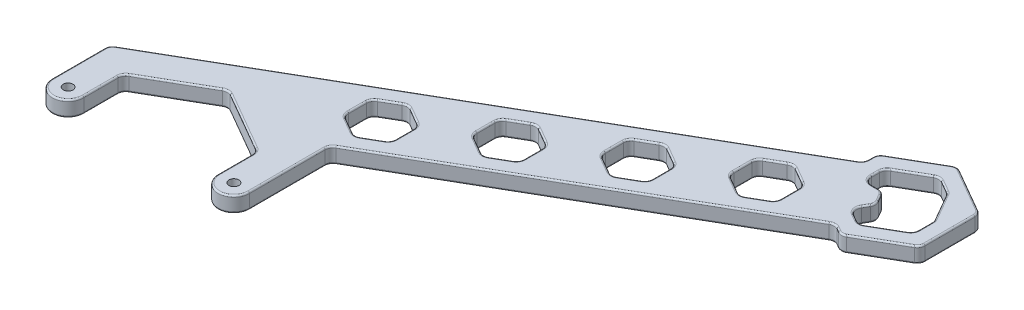
from build123d import *

# Parameters (mm, degrees)
SKETCH1_R              = 2
BOSS_EXTRUDE2_DEPTH    = 6.35
FILLET1_R              = 3.175
FILLET4_R              = 0.635
CUT_EXTRUDE1_DEPTH     = 279.279824808
FILLET3_R              = 3.175
FILLET5_R              = 0.635
LPATTERN2_COUNT        = 4
LPATTERN2_PITCH        = 38.1
FILLET3_OF_LPATTERN2_R = 3.175
FILLET5_OF_LPATTERN2_R = 0.635


with BuildPart() as part:
    # Sketch1 → Boss-Extrude2 (new body)
    with BuildSketch(Plane(origin=(0, 0, 0), x_dir=(1, 0, 0), z_dir=(0, 1, 0))):
        with BuildLine():
            Line((153.979316793, 181.256286034), (-39.941927169, 69.295803631))
            Line((-39.941927169, 69.295803631), (-39.941927169, 46.235321229))
            ThreePointArc((-39.941927169, 46.235321229), (-33.591927169, 39.885321229), (-27.241927169, 46.235321229))
            Line((-27.241927169, 46.235321229), (-27.241927169, 61.963455213))
            Line((-27.241927169, 61.963455213), (0, 77.691589197))
            Line((0, 77.691589197), (27.241927169, 61.963455213))
            Line((27.241927169, 61.963455213), (27.241927169, 46.235321229))
            ThreePointArc((27.241927169, 46.235321229), (33.591927169, 39.885321229), (39.941927169, 46.235321229))
            Line((39.941927169, 46.235321229), (39.941927169, 78.755026343))
            Line((39.941927169, 78.755026343), (169.854316793, 153.759979464))
            Line((169.854316793, 153.759979464), (174.616816793, 151.010348807))
            Line((174.616816793, 151.010348807), (195.254316793, 162.925414987))
            Line((195.254316793, 162.925414987), (195.254316793, 186.755547348))
            Line((195.254316793, 186.755547348), (174.616816793, 198.670613528))
            Line((174.616816793, 198.670613528), (153.979316793, 186.755547348))
            Line((153.979316793, 186.755547348), (153.979316793, 181.256286034))
        make_face()
        Polygon((174.616816793, 191.33826511), (181.760566793, 187.213819124), (188.904316793, 174.840481168), (188.904316793, 166.591589197), (174.616816793, 158.342697225), (167.473066793, 162.467143211), (171.316992662, 169.125018117), (168.017168531, 174.840481168), (160.329316793, 174.840481168), (160.329316793, 183.089373139), align=None, mode=Mode.SUBTRACT)
        with Locations((33.591927169, 46.235321229)):
            Circle(SKETCH1_R, mode=Mode.SUBTRACT)
        with Locations((-33.591927169, 46.235321229)):
            Circle(SKETCH1_R, mode=Mode.SUBTRACT)
    extrude(amount=BOSS_EXTRUDE2_DEPTH)

    # Fillet1
    fillet1_edges = [part.edges().sort_by_distance(p)[0] for p in [
        (-39.941927169, 3.175, -69.295803631),
        (27.241927169, 3.175, -61.963455213),
        (0, 3.175, -77.691589197),
        (-27.241927169, 3.175, -61.963455213),
        (39.941927169, 3.175, -78.755026343),
        (167.473066793, 3.175, -162.467143211),
        (160.329316793, 3.175, -174.840481168),
        (174.616816793, 3.175, -158.342697225),
        (188.904316793, 3.175, -166.591589197),
        (174.616816793, 3.175, -191.33826511),
        (160.329316793, 3.175, -183.089373139),
        (153.979316793, 3.175, -181.256286034),
        (153.979316793, 3.175, -186.755547348),
        (174.616816793, 3.175, -198.670613528),
        (195.254316793, 3.175, -186.755547348),
        (195.254316793, 3.175, -162.925414987),
        (174.616816793, 3.175, -151.010348807),
        (169.854316793, 3.175, -153.759979464),
        (188.904316793, 3.175, -174.840481168),
        (181.760566793, 3.175, -187.213819124),
        (168.017168531, 3.175, -174.840481168),
        (171.316992662, 3.175, -169.125018117),
    ]]
    fillet(fillet1_edges, radius=FILLET1_R)

    # Fillet4
    fillet4_edges = [part.edges().sort_by_distance(p)[0] for p in [
        (40.367296511, 6.35, -78.509439238),
        (39.941927169, 6.35, -61.578630233),
        (33.591927169, 6.35, -39.885321229),
        (27.241927169, 6.35, -53.182844668),
        (26.816557826, 6.35, -61.717868108),
        (13.620963584, 6.35, -69.827522205),
        (0, 6.35, -77.200414987),
        (-13.620963584, 6.35, -69.827522205),
        (-26.816557826, 6.35, -61.717868108),
        (-27.241927169, 6.35, -53.182844668),
        (-33.591927169, 6.35, -39.885321229),
        (-39.941927169, 6.35, -56.849018878),
        (-39.516557826, 6.35, -69.050216527),
        (57.018694812, 6.35, -125.276044833),
        (153.55394745, 6.35, -181.501873139),
        (153.979316793, 6.35, -184.005916691),
        (154.404686136, 6.35, -186.509960243),
        (164.298066793, 6.35, -192.713080438),
        (174.616816793, 6.35, -198.179439319),
        (184.935566793, 6.35, -192.713080438),
        (194.82894745, 6.35, -186.509960243),
        (195.254316793, 6.35, -174.840481168),
        (194.82894745, 6.35, -163.171002092),
        (184.935566793, 6.35, -156.967881897),
        (174.616816793, 6.35, -151.501523016),
        (172.235566793, 6.35, -152.385164135),
        (169.854316793, 6.35, -153.268805254),
        (104.898121981, 6.35, -116.257502903),
        (-39.516557826, 0, -69.050216527),
        (-39.941927169, 0, -56.849018878),
        (-33.591927169, 0, -39.885321229),
        (-27.241927169, 0, -53.182844668),
        (-26.816557826, 0, -61.717868108),
        (-13.620963584, 0, -69.827522205),
        (0, 0, -77.200414987),
        (13.620963584, 0, -69.827522205),
        (26.816557826, 0, -61.717868108),
        (27.241927169, 0, -53.182844668),
        (33.591927169, 0, -39.885321229),
        (39.941927169, 0, -61.578630233),
        (40.367296511, 0, -78.509439238),
        (104.898121981, 0, -116.257502903),
        (169.854316793, 0, -153.268805254),
        (172.235566793, 0, -152.385164135),
        (174.616816793, 0, -151.501523016),
        (184.935566793, 0, -156.967881897),
        (194.82894745, 0, -163.171002092),
        (195.254316793, 0, -174.840481168),
        (194.82894745, 0, -186.509960243),
        (184.935566793, 0, -192.713080438),
        (174.616816793, 0, -198.179439319),
        (164.298066793, 0, -192.713080438),
        (154.404686136, 0, -186.509960243),
        (153.979316793, 0, -184.005916691),
        (153.55394745, 0, -181.501873139),
        (57.018694812, 0, -125.276044833),
        (181.681369509, 0, -187.13462184),
        (178.614061136, 0, -189.030455012),
        (174.616816793, 0, -190.8470909),
        (167.473066793, 0, -187.213819124),
        (160.754686136, 0, -182.843786034),
        (160.329316793, 0, -179.635883601),
        (161.259252763, 0, -175.770417137),
        (164.844199109, 0, -174.840481168),
        (167.771581426, 0, -174.415111825),
        (169.667080596, 0, -171.982749642),
        (170.825818452, 0, -169.125018117),
        (169.730507951, 0, -166.377145992),
        (168.743382951, 0, -162.8075234),
        (171.626007121, 0, -160.069441994),
        (174.616816793, 0, -158.833871435),
        (181.760566793, 0, -162.467143211),
        (188.47894745, 0, -166.837176301),
        (188.904316793, 0, -171.207209391),
        (188.796131291, 0, -174.81149295),
        (181.681369509, 6.35, -187.13462184),
        (178.614061136, 6.35, -189.030455012),
        (174.616816793, 6.35, -190.8470909),
        (167.473066793, 6.35, -187.213819124),
        (160.754686136, 6.35, -182.843786034),
        (160.329316793, 6.35, -179.635883601),
        (161.259252763, 6.35, -175.770417137),
        (164.844199109, 6.35, -174.840481168),
        (167.771581426, 6.35, -174.415111825),
        (169.667080596, 6.35, -171.982749642),
        (170.825818452, 6.35, -169.125018117),
        (169.730507951, 6.35, -166.377145992),
        (168.743382951, 6.35, -162.8075234),
        (171.626007121, 6.35, -160.069441994),
        (174.616816793, 6.35, -158.833871435),
        (181.760566793, 6.35, -162.467143211),
        (188.47894745, 6.35, -166.837176301),
        (188.904316793, 6.35, -171.207209391),
        (188.796131291, 6.35, -174.81149295),
        (185.332441793, 0, -181.027150146),
        (185.332441793, 6.35, -181.027150146),
    ]]
    fillet(fillet4_edges, radius=FILLET4_R)

    # Sketch3 → Cut-Extrude1 (cut, through all)
    with BuildSketch(Plane(origin=(0, 6.35, 0), x_dir=(1, 0, 0), z_dir=(0, 1, 0))):
        Polygon((41.529427169, 109.00096357), (32.004427169, 103.501702256), (32.004427169, 92.503179628), (41.529427169, 87.003918314), (51.054427169, 92.503179628), (51.054427169, 103.501702256), align=None)
    cut_extrude1 = extrude(amount=-CUT_EXTRUDE1_DEPTH, mode=Mode.SUBTRACT)

    # Fillet3
    fillet3_edges = [part.edges().sort_by_distance(p)[0] for p in [
        (32.004427169, 3.175, -92.503179628),
        (41.529427169, 3.175, -87.003918314),
        (51.054427169, 3.175, -92.503179628),
        (51.054427169, 3.175, -103.501702256),
        (41.529427169, 3.175, -109.00096357),
        (32.004427169, 3.175, -103.501702256),
    ]]
    fillet(fillet3_edges, radius=FILLET3_R)

    # Fillet5
    fillet5_edges = [part.edges().sort_by_distance(p)[0] for p in [
        (50.629057826, 0, -103.256115152),
        (51.054427169, 0, -98.002440942),
        (50.629057826, 0, -92.748766733),
        (46.291927169, 0, -89.753548971),
        (41.529427169, 0, -87.495092523),
        (36.766927169, 0, -89.753548971),
        (32.429796511, 0, -92.748766733),
        (32.004427169, 0, -98.002440942),
        (32.429796511, 0, -103.256115152),
        (36.766927169, 0, -106.251332913),
        (41.529427169, 0, -108.509789361),
        (41.529427169, 6.35, -108.509789361),
        (46.291927169, 6.35, -106.251332913),
        (50.629057826, 6.35, -103.256115152),
        (51.054427169, 6.35, -98.002440942),
        (50.629057826, 6.35, -92.748766733),
        (46.291927169, 6.35, -89.753548971),
        (41.529427169, 6.35, -87.495092523),
        (36.766927169, 6.35, -89.753548971),
        (32.429796511, 6.35, -92.748766733),
        (32.004427169, 6.35, -98.002440942),
        (32.429796511, 6.35, -103.256115152),
        (46.291927169, 0, -106.251332913),
        (36.766927169, 6.35, -106.251332913),
    ]]
    fillet(fillet5_edges, radius=FILLET5_R)

    # LPattern2: Cut-Extrude1 ×4
    with Locations(*[Vector(0.8660254037844378, 0, -0.5000000000000017) * (i * LPATTERN2_PITCH) for i in range(1, LPATTERN2_COUNT)]):
        add(cut_extrude1, mode=Mode.SUBTRACT)

    # Fillet3 of LPattern2
    fillet3_of_lpattern2_edges = [part.edges().sort_by_distance(p)[0] for p in [
        (64.999995053, 3.175, -111.553179628),
        (74.524995053, 3.175, -106.053918314),
        (84.049995053, 3.175, -111.553179628),
        (84.049995053, 3.175, -122.551702256),
        (74.524995053, 3.175, -128.05096357),
        (64.999995053, 3.175, -122.551702256),
        (97.995562937, 3.175, -130.603179628),
        (107.520562937, 3.175, -125.103918314),
        (117.045562937, 3.175, -130.603179628),
        (117.045562937, 3.175, -141.601702256),
        (107.520562937, 3.175, -147.10096357),
        (97.995562937, 3.175, -141.601702256),
        (130.991130821, 3.175, -149.653179628),
        (140.516130821, 3.175, -144.153918314),
        (150.041130821, 3.175, -149.653179628),
        (150.041130821, 3.175, -160.651702256),
        (140.516130821, 3.175, -166.15096357),
        (130.991130821, 3.175, -160.651702256),
    ]]
    fillet(fillet3_of_lpattern2_edges, radius=FILLET3_OF_LPATTERN2_R)

    # Fillet5 of LPattern2
    fillet5_of_lpattern2_edges = [part.edges().sort_by_distance(p)[0] for p in [
        (83.62462571, 0, -122.306115152),
        (84.049995053, 0, -117.052440942),
        (83.62462571, 0, -111.798766733),
        (79.287495053, 0, -108.803548971),
        (74.524995053, 0, -106.545092523),
        (69.762495053, 0, -108.803548971),
        (65.425364396, 0, -111.798766733),
        (64.999995053, 0, -117.052440942),
        (65.425364396, 0, -122.306115152),
        (69.762495053, 0, -125.301332913),
        (74.524995053, 0, -127.559789361),
        (74.524995053, 6.35, -127.559789361),
        (79.287495053, 6.35, -125.301332913),
        (83.62462571, 6.35, -122.306115152),
        (84.049995053, 6.35, -117.052440942),
        (83.62462571, 6.35, -111.798766733),
        (79.287495053, 6.35, -108.803548971),
        (74.524995053, 6.35, -106.545092523),
        (69.762495053, 6.35, -108.803548971),
        (65.425364396, 6.35, -111.798766733),
        (64.999995053, 6.35, -117.052440942),
        (65.425364396, 6.35, -122.306115152),
        (79.287495053, 0, -125.301332913),
        (69.762495053, 6.35, -125.301332913),
        (116.620193594, 0, -141.356115152),
        (117.045562937, 0, -136.102440942),
        (116.620193594, 0, -130.848766733),
        (112.283062937, 0, -127.853548971),
        (107.520562937, 0, -125.595092523),
        (102.758062937, 0, -127.853548971),
        (98.42093228, 0, -130.848766733),
        (97.995562937, 0, -136.102440942),
        (98.42093228, 0, -141.356115152),
        (102.758062937, 0, -144.351332913),
        (107.520562937, 0, -146.609789361),
        (107.520562937, 6.35, -146.609789361),
        (112.283062937, 6.35, -144.351332913),
        (116.620193594, 6.35, -141.356115152),
        (117.045562937, 6.35, -136.102440942),
        (116.620193594, 6.35, -130.848766733),
        (112.283062937, 6.35, -127.853548971),
        (107.520562937, 6.35, -125.595092523),
        (102.758062937, 6.35, -127.853548971),
        (98.42093228, 6.35, -130.848766733),
        (97.995562937, 6.35, -136.102440942),
        (98.42093228, 6.35, -141.356115152),
        (112.283062937, 0, -144.351332913),
        (102.758062937, 6.35, -144.351332913),
        (149.615761478, 0, -160.406115152),
        (150.041130821, 0, -155.152440942),
        (149.615761478, 0, -149.898766733),
        (145.278630821, 0, -146.903548971),
        (140.516130821, 0, -144.645092523),
        (135.753630821, 0, -146.903548971),
        (131.416500164, 0, -149.898766733),
        (130.991130821, 0, -155.152440942),
        (131.416500164, 0, -160.406115152),
        (135.753630821, 0, -163.401332913),
        (140.516130821, 0, -165.659789361),
        (140.516130821, 6.35, -165.659789361),
        (145.278630821, 6.35, -163.401332913),
        (149.615761478, 6.35, -160.406115152),
        (150.041130821, 6.35, -155.152440942),
        (149.615761478, 6.35, -149.898766733),
        (145.278630821, 6.35, -146.903548971),
        (140.516130821, 6.35, -144.645092523),
        (135.753630821, 6.35, -146.903548971),
        (131.416500164, 6.35, -149.898766733),
        (130.991130821, 6.35, -155.152440942),
        (131.416500164, 6.35, -160.406115152),
        (145.278630821, 0, -163.401332913),
        (135.753630821, 6.35, -163.401332913),
    ]]
    fillet(fillet5_of_lpattern2_edges, radius=FILLET5_OF_LPATTERN2_R)


solid = part.part
